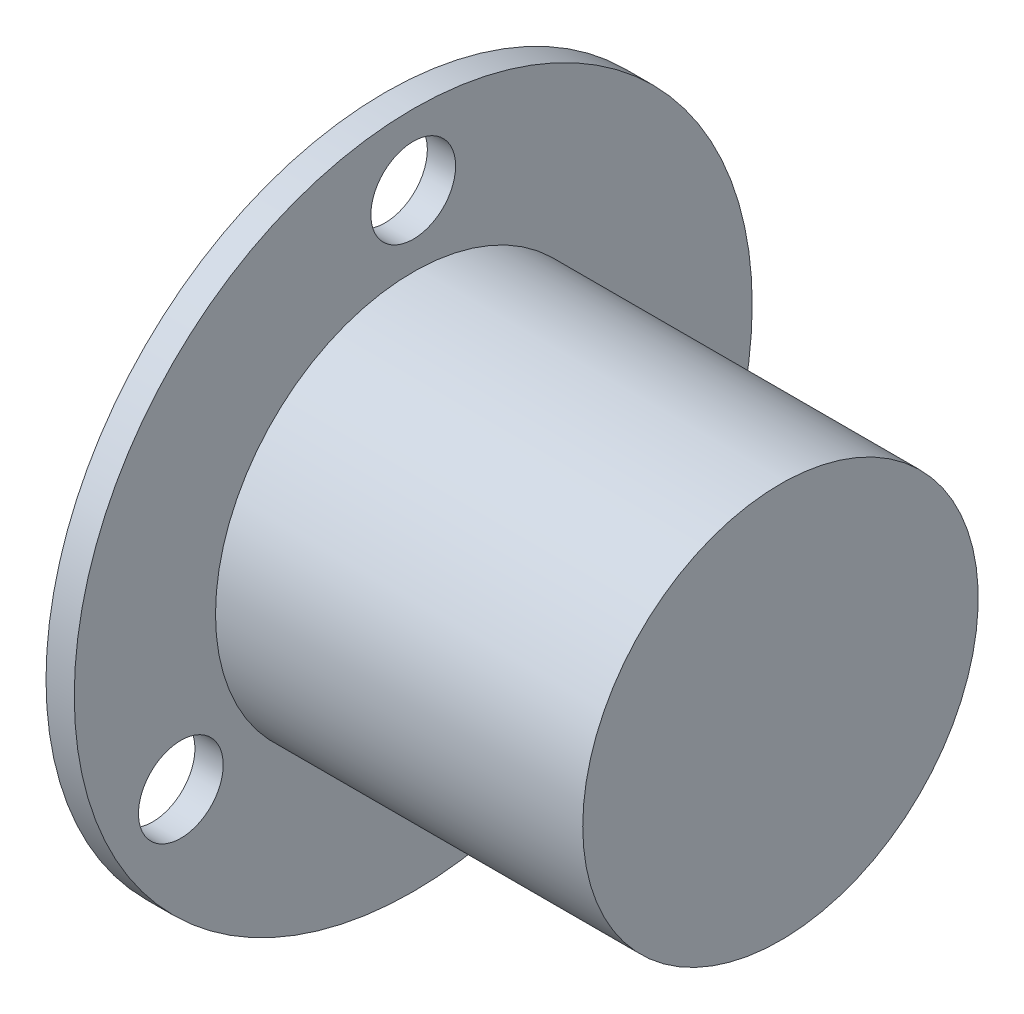
from build123d import *

# Parameters (mm, degrees)
SKETCH1_R           = 12
BOSS_EXTRUDE1_DEPTH = 1
SKETCH2_R           = 7
BOSS_EXTRUDE2_DEPTH = 13
SKETCH3_R           = 1.5
CUT_EXTRUDE1_DEPTH  = 1
SKETCH4_R           = 2.5
BOSS_EXTRUDE3_DEPTH = 5


with BuildPart() as part:
    # Sketch1 → Boss-Extrude1 (new body)
    with BuildSketch(Plane(origin=(0, 0, 0), x_dir=(0, 0, -1), z_dir=(1, 0, 0))):
        Circle(SKETCH1_R)
    extrude(amount=BOSS_EXTRUDE1_DEPTH)

    # Sketch2 → Boss-Extrude2 (add)
    with BuildSketch(Plane(origin=(1, 0, 0), x_dir=(0, 0, -1), z_dir=(1, 0, 0))):
        with Locations(Location((0, 0, 0), (0, 0, 180))):
            Circle(SKETCH2_R)
    extrude(amount=BOSS_EXTRUDE2_DEPTH)

    # Sketch3 → Cut-Extrude1 (cut)
    with BuildSketch(Plane(origin=(1, 0, 0), x_dir=(0, 0, -1), z_dir=(1, 0, 0))):
        with Locations((0, 9.5)):
            Circle(SKETCH3_R)
        with Locations((8.227241336, -4.75)):
            Circle(SKETCH3_R)
        with Locations((-8.227241336, -4.75)):
            Circle(SKETCH3_R)
    extrude(amount=-CUT_EXTRUDE1_DEPTH, mode=Mode.SUBTRACT)

    # Sketch4 → Boss-Extrude3 (add)
    with BuildSketch(Plane.ZY):
        with Locations(Location((0, 0, 0), (0, 0, 180))):
            Circle(SKETCH4_R)
    extrude(amount=BOSS_EXTRUDE3_DEPTH)


solid = part.part
